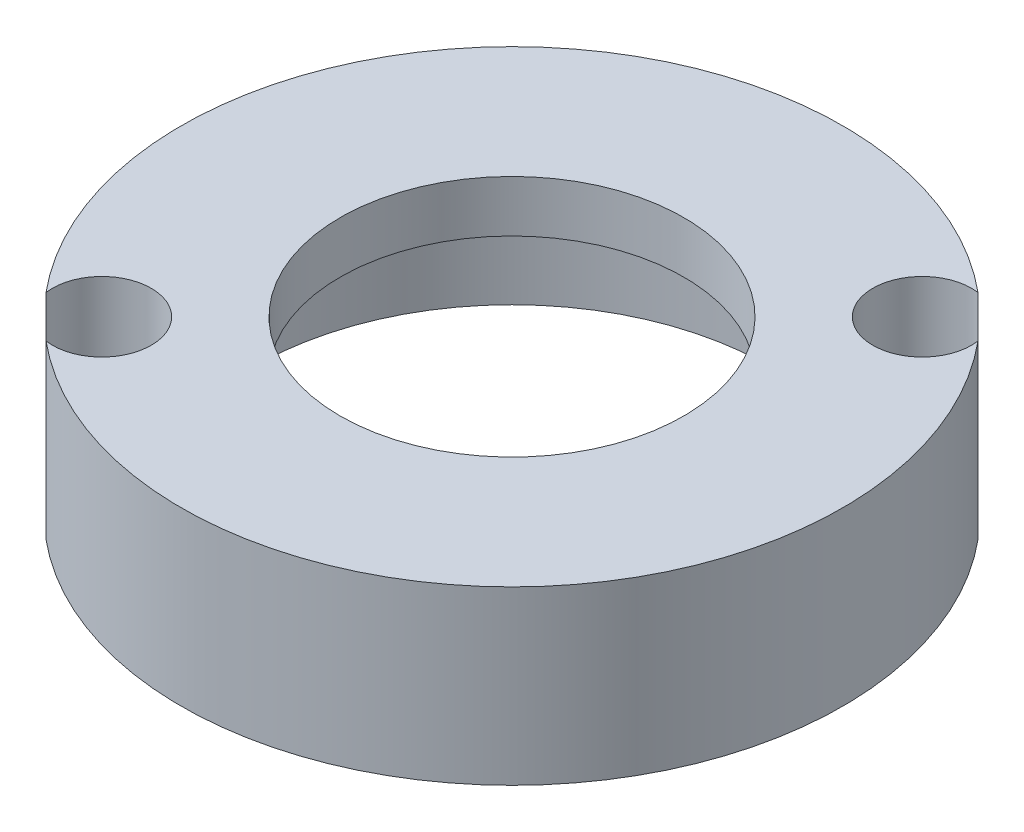
from build123d import *

# Parameters (mm, degrees)
SKETCH1_R           = 7.7
SKETCH1_R_2         = 4
BOSS_EXTRUDE1_DEPTH = 4
SKETCH2_R           = 6
CUT_EXTRUDE1_DEPTH  = 2.8
SKETCH3_R           = 1.15
CUT_EXTRUDE2_DEPTH  = 12.600862037


with BuildPart() as part:
    # Sketch1 → Boss-Extrude1 (new body)
    with BuildSketch(Plane(origin=(0, 0, 0), x_dir=(1, 0, 0), z_dir=(0, 1, 0))):
        with Locations(Location((0, 0, 0), (0, 0, 270))):
            Circle(SKETCH1_R)
        with Locations(Location((0, 0, 0), (0, 0, 270))):
            Circle(SKETCH1_R_2, mode=Mode.SUBTRACT)
    extrude(amount=BOSS_EXTRUDE1_DEPTH)

    # Sketch2 → Cut-Extrude1 (cut)
    with BuildSketch(Plane.XZ):
        with Locations(Location((0, 0, 0), (0, 0, 270))):
            Circle(SKETCH2_R)
    extrude(amount=-CUT_EXTRUDE1_DEPTH, mode=Mode.SUBTRACT)

    # Sketch3 → Cut-Extrude2 (cut, through all)
    with BuildSketch(Plane(origin=(0, 4, 0), x_dir=(1, 0, 0), z_dir=(0, 1, 0))):
        with Locations((4.772970773, 4.772970773)):
            Circle(SKETCH3_R)
        with Locations((-4.772970773, -4.772970773)):
            Circle(SKETCH3_R)
    extrude(amount=-CUT_EXTRUDE2_DEPTH, mode=Mode.SUBTRACT)


solid = part.part
